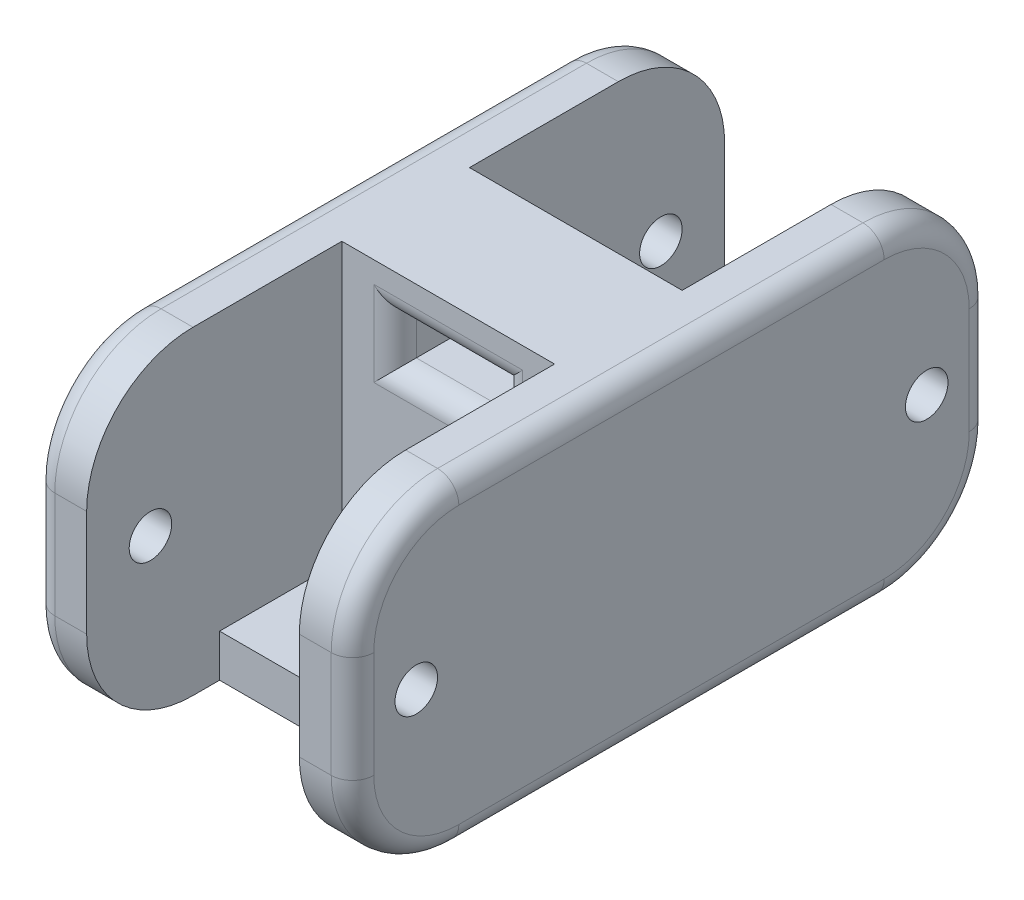
from build123d import *

# Parameters (mm, degrees)
BOTTOM_SECTION_BASE_SKETCH_W     = 15
BOTTOM_SECTION_BASE_SKETCH_H     = 15
BOTTOM_SECTION_EXTRUDE_DEPTH     = 30
HINGE_CUTOUT_SKETCH_W            = 10
HINGE_CUTOUT_SKETCH_H            = 15
HINGE_CUTOUT_EXTRUDED_CUT_DEPTH  = 12
HINGE_HOLE_SKETCH_R              = 1
HINGE_HOLE_EXTRUDED_CUT_DEPTH    = 35.369317712
HINGER_CORNER_FILLETS_R          = 5
STYLE_FILLETS_R                  = 1
ROUTING_HOLES_SKETCH_W           = 5
ROUTING_HOLES_SKETCH_H           = 2
ROUTING_HOLES_EXTRUDED_CUT_DEPTH = 32.819805177
BACKING_SKETCH_W                 = 10
BACKING_SKETCH_H                 = 2
BACKING_EXTRUDE_DEPTH            = 5.75
ROUTING_FILLETS_R                = 1


with BuildPart() as part:
    # Bottom Section Base Sketch → Bottom Section Extrude (new body)
    with BuildSketch(Plane.XY):
        Rectangle(BOTTOM_SECTION_BASE_SKETCH_W, BOTTOM_SECTION_BASE_SKETCH_H)
    extrude(amount=BOTTOM_SECTION_EXTRUDE_DEPTH)

    # Hinge Cutout Sketch → Hinge Cutout Extruded Cut (cut)
    with BuildSketch(Plane.XY):
        Rectangle(HINGE_CUTOUT_SKETCH_W, HINGE_CUTOUT_SKETCH_H)
    hinge_cutout_extruded_cut = extrude(amount=HINGE_CUTOUT_EXTRUDED_CUT_DEPTH, mode=Mode.SUBTRACT)

    # Hinge Hole Sketch → Hinge Hole Extruded Cut (cut, through all)
    with BuildSketch(Plane(origin=(7.5, 0, 0), x_dir=(0, 0, -1), z_dir=(1, 0, 0))):
        with Locations((-3, 0)):
            Circle(HINGE_HOLE_SKETCH_R)
    hinge_hole_extruded_cut = extrude(amount=-HINGE_HOLE_EXTRUDED_CUT_DEPTH, mode=Mode.SUBTRACT)

    # Hinge and Hole Cutout Mirror: Hinge Cutout Extruded Cut, Hinge Hole Extruded Cut across plane
    add(hinge_cutout_extruded_cut.mirror(Plane.XY.offset(15)), mode=Mode.SUBTRACT)
    add(hinge_hole_extruded_cut.mirror(Plane.XY.offset(15)), mode=Mode.SUBTRACT)

    # Hinger Corner Fillets
    hinger_corner_fillets_edges = [part.edges().sort_by_distance(p)[0] for p in [
        (6.25, -7.5, 0),
        (-6.25, 7.5, 0),
        (-6.25, -7.5, 30),
        (-6.25, 7.5, 30),
        (6.25, -7.5, 30),
        (-6.25, -7.5, 0),
        (6.25, 7.5, 0),
        (6.25, 7.5, 30),
    ]]
    fillet(hinger_corner_fillets_edges, radius=HINGER_CORNER_FILLETS_R)

    # Style Fillets
    style_fillets_edges = [part.edges().sort_by_distance(p)[0] for p in [
        (7.5, 0, 30),
        (7.5, 7.5, 15),
        (-7.5, 7.5, 15),
        (7.5, 0, 0),
        (7.5, -7.5, 15),
        (7.5, 6.035533906, 1.464466094),
        (7.5, -6.035533906, 1.464466094),
        (7.5, -6.035533906, 28.535533906),
        (7.5, 6.035533906, 28.535533906),
        (-7.5, -7.5, 15),
        (-7.5, 0, 30),
        (-7.5, 0, 0),
        (-7.5, -6.035533906, 1.464466094),
        (-7.5, 6.035533906, 1.464466094),
        (-7.5, 6.035533906, 28.535533906),
        (-7.5, -6.035533906, 28.535533906),
    ]]
    fillet(style_fillets_edges, radius=STYLE_FILLETS_R)

    # Routing Holes Sketch → Routing Holes Extruded Cut (cut, through all)
    with BuildSketch(Plane.XY):
        with Locations((0, 4.5)):
            Rectangle(ROUTING_HOLES_SKETCH_W, ROUTING_HOLES_SKETCH_H)
        with Locations((0, -4.5)):
            Rectangle(ROUTING_HOLES_SKETCH_W, ROUTING_HOLES_SKETCH_H)
    extrude(amount=ROUTING_HOLES_EXTRUDED_CUT_DEPTH, mode=Mode.SUBTRACT)

    # Backing Sketch → Backing Extrude (add)
    with BuildSketch(Plane.XY.offset(18)):
        with Locations((0, -6.5)):
            Rectangle(BACKING_SKETCH_W, BACKING_SKETCH_H)
    extrude(amount=BACKING_EXTRUDE_DEPTH)

    # Routing Fillets
    routing_fillets_edges = [part.edges().sort_by_distance(p)[0] for p in [
        (-2.5, -4.5, 18),
        (0, -3.5, 18),
        (2.5, -4.5, 18),
        (0, 5.5, 18),
        (2.5, 4.5, 18),
        (0, 3.5, 18),
        (-2.5, 4.5, 18),
        (-2.5, 4.5, 12),
        (0, 3.5, 12),
        (2.5, 4.5, 12),
        (0, 5.5, 12),
        (0, -5.5, 12),
        (2.5, -4.5, 12),
        (0, -3.5, 12),
        (-2.5, -4.5, 12),
    ]]
    fillet(routing_fillets_edges, radius=ROUTING_FILLETS_R)


solid = part.part
